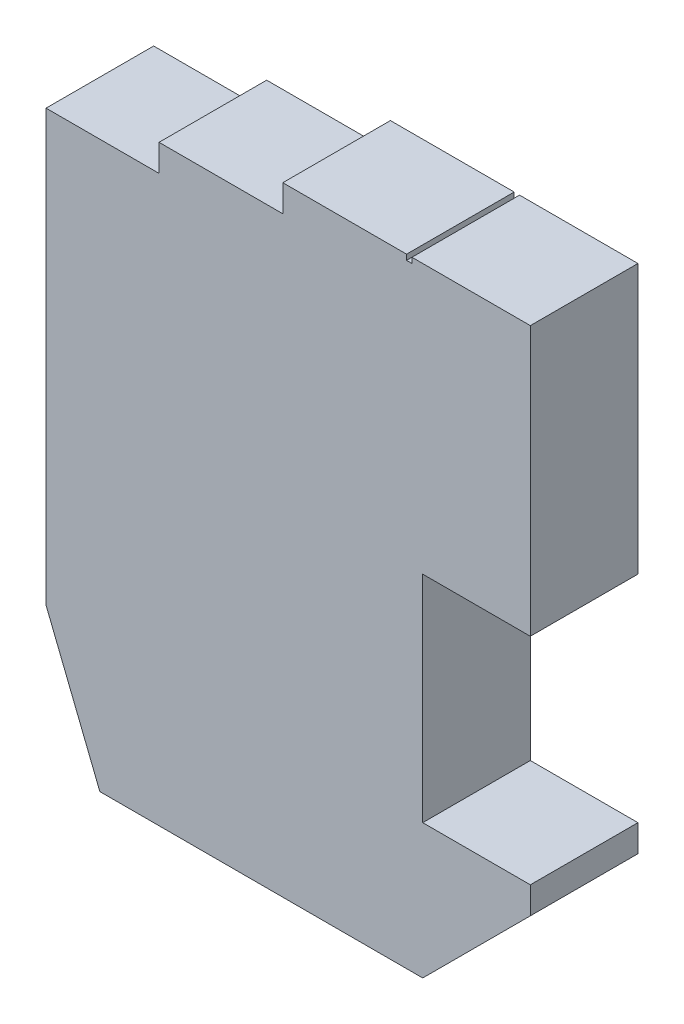
from build123d import *

# Parameters (mm, degrees)
BOSS_EXTRUDE1_DEPTH = 20
SKETCH2_W           = 20
SKETCH2_H           = 40
CUT_EXTRUDE1_DEPTH  = 142.509716981


with BuildPart() as part:
    # Sketch1 → Boss-Extrude1 (new body)
    with BuildSketch(Plane.XY):
        Polygon((58, 114), (58, 115), (80, 115), (80, 20), (60, 0), (0, 0), (-10, 25), (-10, 105), (11, 105), (11, 110), (12, 110), (34, 110), (34, 115), (35, 115), (57, 115), (57, 114), align=None)
    extrude(amount=BOSS_EXTRUDE1_DEPTH)

    # Sketch2 → Cut-Extrude1 (cut, through all)
    with BuildSketch(Plane.XY.offset(20)):
        with Locations((70, 45)):
            Rectangle(SKETCH2_W, SKETCH2_H)
    extrude(amount=-CUT_EXTRUDE1_DEPTH, mode=Mode.SUBTRACT)


solid = part.part
